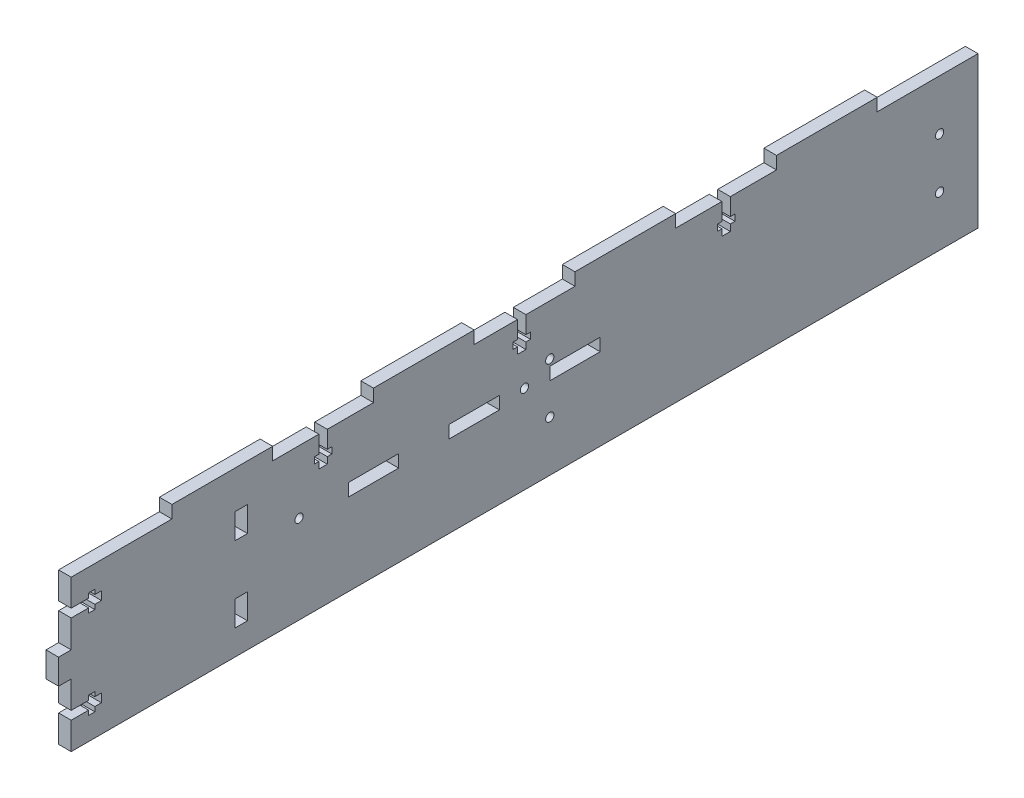
from build123d import *

# Parameters (mm, degrees)
SKETCH1_W           = 6.35
SKETCH1_H           = 76.2
BOSS_EXTRUDE1_DEPTH = 457.2
SKETCH2_W           = 6.35
SKETCH2_H           = 50.8
BOSS_EXTRUDE2_DEPTH = 6.35
SKETCH3_W           = 6.35
SKETCH3_H           = 12.7
CUT_EXTRUDE1_DEPTH  = 460.399570091
SKETCH4_W           = 6.35
SKETCH4_H           = 12.7
BOSS_EXTRUDE4_DEPTH = 6.35
SKETCH7_R           = 2.0955
CUT_EXTRUDE2_DEPTH  = 460.399570091
SKETCH9_R           = 2.0955
SKETCH9_W           = 25.4
SKETCH9_H           = 6.35
CUT_EXTRUDE3_DEPTH  = 6.35
CUT_EXTRUDE4_DEPTH  = 6.35


with BuildPart() as part:
    # Sketch1 → Boss-Extrude1 (new body)
    with BuildSketch(Plane.XY):
        with Locations((-41.275, 0)):
            Rectangle(SKETCH1_W, SKETCH1_H)
    extrude(amount=-BOSS_EXTRUDE1_DEPTH)

    # Sketch2 → Boss-Extrude2 (add)
    with BuildSketch(Plane(origin=(0, 38.1, 0), x_dir=(1, 0, 0), z_dir=(0, 1, 0))):
        with Locations((-41.275, 381)):
            Rectangle(SKETCH2_W, SKETCH2_H)
        with Locations((-41.275, 279.4)):
            Rectangle(SKETCH2_W, SKETCH2_H)
        with Locations((-41.275, 177.8)):
            Rectangle(SKETCH2_W, SKETCH2_H)
        with Locations((-41.275, 76.2)):
            Rectangle(SKETCH2_W, SKETCH2_H)
    extrude(amount=BOSS_EXTRUDE2_DEPTH)

    # Sketch3 → Cut-Extrude1 (cut, through all)
    with BuildSketch(Plane(origin=(-38.1, 0, 0), x_dir=(0, 0, -1), z_dir=(1, 0, 0))):
        with Locations((85.725, 19.05)):
            Rectangle(SKETCH3_W, SKETCH3_H)
        with Locations((85.725, -19.05)):
            Rectangle(SKETCH3_W, SKETCH3_H)
    extrude(amount=-CUT_EXTRUDE1_DEPTH, mode=Mode.SUBTRACT)

    # Sketch4 → Boss-Extrude4 (add)
    with BuildSketch(Plane.XY):
        with Locations((-41.275, 0)):
            Rectangle(SKETCH4_W, SKETCH4_H)
    extrude(amount=BOSS_EXTRUDE4_DEPTH)

    # Sketch7 → Cut-Extrude2 (cut, through all)
    with BuildSketch(Plane.ZY.offset(44.45)):
        with Locations((-241.3, -12.7)):
            Circle(SKETCH7_R)
        with Locations((-241.3, 12.7)):
            Circle(SKETCH7_R)
        with Locations((-437.8325, -12.7)):
            Circle(SKETCH7_R)
        with Locations((-437.8325, 12.7)):
            Circle(SKETCH7_R)
    extrude(amount=-CUT_EXTRUDE2_DEPTH, mode=Mode.SUBTRACT)

    # Sketch9 → Cut-Extrude3 (cut)
    with BuildSketch(Plane.ZY.offset(44.45)):
        with Locations((-114.880216651, 6.35)):
            Circle(SKETCH9_R)
        with Locations((-228.517018256, 6.35)):
            Circle(SKETCH9_R)
        with Locations((-254, 6.35)):
            Rectangle(SKETCH9_W, SKETCH9_H)
        with Locations((-203.2, 6.35)):
            Rectangle(SKETCH9_W, SKETCH9_H)
        with Locations((-152.4, 6.35)):
            Rectangle(SKETCH9_W, SKETCH9_H)
    extrude(amount=-CUT_EXTRUDE3_DEPTH, mode=Mode.SUBTRACT)

    # Sketch10 → Cut-Extrude4 (cut)
    with BuildSketch(Plane(origin=(-38.1, 0, 0), x_dir=(0, 0, -1), z_dir=(1, 0, 0))):
        Polygon((0, 24.548534751), (0, 20.281334751), (8.763, 20.281334751), (8.763, 17.969934751), (11.938, 17.969934751), (11.938, 20.281334751), (15.24, 20.281334751), (15.24, 24.548534751), (11.938, 24.548534751), (11.938, 26.859934751), (8.763, 26.859934751), (8.763, 24.548534751), align=None)
        Polygon((0, -20.0914), (0, -24.3586), (8.763, -24.3586), (8.763, -26.67), (11.938, -26.67), (11.938, -24.3586), (15.24, -24.3586), (15.24, -20.0914), (11.938, -20.0914), (11.938, -17.78), (8.763, -17.78), (8.763, -20.0914), align=None)
        Polygon((332.3336, 38.1), (328.0664, 38.1), (328.0664, 29.337), (325.755, 29.337), (325.755, 26.162), (328.0664, 26.162), (328.0664, 22.86), (332.3336, 22.86), (332.3336, 26.162), (334.645, 26.162), (334.645, 29.337), (332.3336, 29.337), align=None)
        Polygon((229.270305867, 38.1), (225.003105867, 38.1), (225.003105867, 29.337), (222.691705867, 29.337), (222.691705867, 26.162), (225.003105867, 26.162), (225.003105867, 22.86), (229.270305867, 22.86), (229.270305867, 26.162), (231.581705867, 26.162), (231.581705867, 29.337), (229.270305867, 29.337), align=None)
        Polygon((129.1336, 38.1), (124.8664, 38.1), (124.8664, 29.337), (122.555, 29.337), (122.555, 26.162), (124.8664, 26.162), (124.8664, 22.86), (129.1336, 22.86), (129.1336, 26.162), (131.445, 26.162), (131.445, 29.337), (129.1336, 29.337), align=None)
    extrude(amount=-CUT_EXTRUDE4_DEPTH, mode=Mode.SUBTRACT)


solid = part.part
